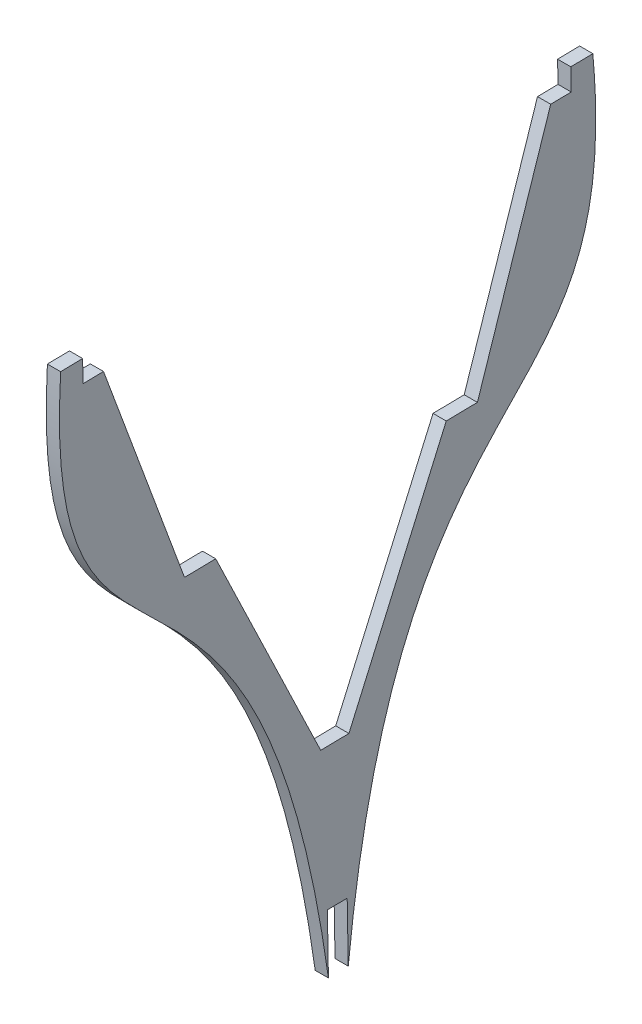
from build123d import *

# Parameters (mm, degrees)
BOSS_EXTRU_3_DEPTH      = 6
ENL_V_MAT_EXTRU_1_DEPTH = 6


with BuildPart() as part:
    # Esquisse2 → Boss.-Extru.3 (new body)
    with BuildSketch(Plane(origin=(0, 0, 0), x_dir=(0, 0, -1), z_dir=(1, 0, 0))):
        with BuildLine():
            Line((-127.304421382, 367.164311993), (-117.304421382, 367.339235976))
            Line((-117.304421382, 367.339235976), (-117.129497399, 357.339235976))
            Line((-117.129497399, 357.339235976), (-107.821244193, 357.502059649))
            Line((-107.821244193, 357.502059649), (-71.035103248, 258.130239448))
            Line((-71.035103248, 258.130239448), (-56.879883539, 258.377848189))
            Line((-56.879883539, 258.377848189), (-9.189787464, 159.196764314))
            Line((-9.189787464, 159.196764314), (3.616402558, 159.420775291))
            Line((3.616402558, 159.420775291), (47.808554092, 260.209100037))
            Line((47.808554092, 260.209100037), (61.963773801, 260.456708778))
            Line((61.963773801, 260.456708778), (95.251970204, 361.054297197))
            Line((95.251970204, 361.054297197), (104.56022341, 361.21712087))
            Line((104.56022341, 361.21712087), (104.385299427, 371.21712087))
            Line((104.385299427, 371.21712087), (114.385299427, 371.392044853))
            add(Edge.make_bspline(
                [(114.385299427, 371.392044853), (129.236169542, 207.779320372), (14.043002516, 310.158145021), (-0.343298323, 19.625572046)],
                knots=[0, 0, 0, 0, 1, 1, 1, 1], degree=3))
            add(Edge.make_bspline(
                [(-127.304421382, 367.164311993), (-136.423999039, 203.132286892), (-24.881911728, 309.477254917), (-0.343298323, 19.625572046)],
                knots=[0, 0, 0, 0, 1, 1, 1, 1], degree=3))
        make_face()
    extrude(amount=BOSS_EXTRU_3_DEPTH)

    # Esquisse3 → Enlèv. mat.-Extru.1 (cut)
    with BuildSketch(Plane(origin=(6, 0, 0), x_dir=(0, 0, -1), z_dir=(1, 0, 0))):
        Polygon((-5.689255953, 67.908299674), (-6.161550707, 94.908299674), (2.838449293, 95.065731258), (3.310744047, 68.065731258), (55.065948486, -14.421177966), (-79.522524648, 25.192707995), align=None)
    extrude(amount=-ENL_V_MAT_EXTRU_1_DEPTH, mode=Mode.SUBTRACT)


solid = part.part
